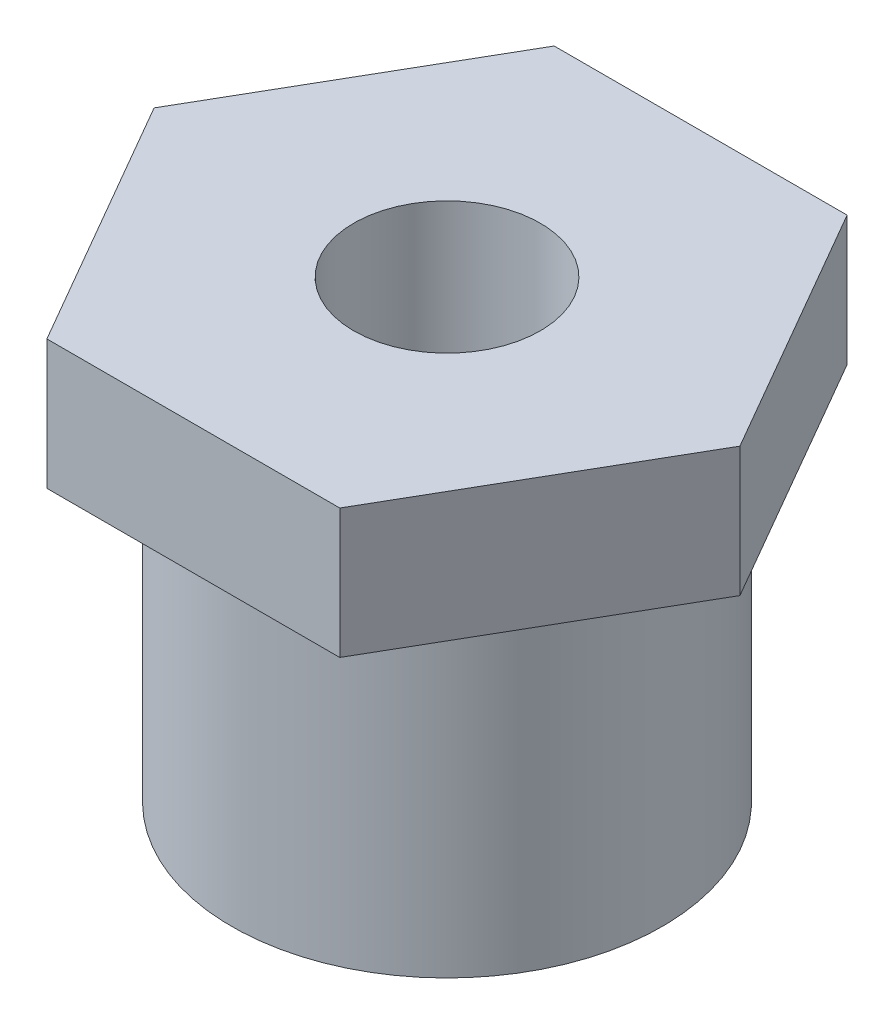
from build123d import *

# Parameters (mm, degrees)
BOSS_EXTRUDE1_DEPTH = 8.0518
SKETCH2_R           = 13.39215
BOSS_EXTRUDE2_DEPTH = 20.2438
SKETCH3_R           = 5.8039
CUT_EXTRUDE1_DEPTH  = 10.3886
SKETCH4_R           = 8.0137
CUT_EXTRUDE2_DEPTH  = 16.1925


with BuildPart() as part:
    # Sketch1 → Boss-Extrude1 (new body)
    with BuildSketch(Plane(origin=(0, 0, 0), x_dir=(1, 0, 0), z_dir=(0, 1, 0))):
        Polygon((18.22088582, 0), (9.11044291, 15.77975), (-9.11044291, 15.77975), (-18.22088582, 0), (-9.11044291, -15.77975), (9.11044291, -15.77975), align=None)
    extrude(amount=BOSS_EXTRUDE1_DEPTH)

    # Sketch2 → Boss-Extrude2 (add)
    with BuildSketch(Plane(origin=(0, 0, 0), x_dir=(-1, 0, 0), z_dir=(0, -1, 0))):
        with Locations(Location((0, 0, 0), (0, 0, 90))):
            Circle(SKETCH2_R)
    extrude(amount=BOSS_EXTRUDE2_DEPTH)

    # Sketch3 → Cut-Extrude1 (cut)
    with BuildSketch(Plane(origin=(0, 8.0518, 0), x_dir=(1, 0, 0), z_dir=(0, 1, 0))):
        with Locations(Location((0, 0, 0), (0, 0, 270))):
            Circle(SKETCH3_R)
    extrude(amount=-CUT_EXTRUDE1_DEPTH, mode=Mode.SUBTRACT)

    # Sketch4 → Cut-Extrude2 (cut)
    with BuildSketch(Plane.XZ.offset(20.2438)):
        with Locations(Location((0, 0, 0), (0, 0, 270))):
            Circle(SKETCH4_R)
    extrude(amount=-CUT_EXTRUDE2_DEPTH, mode=Mode.SUBTRACT)

    # Sketch5 → Cut-Revolve4 (revolve, cut)
    with BuildSketch(Plane.XY, mode=Mode.PRIVATE) as cut_revolve4_sk:
        Polygon((0, -2.3368), (0, -4.0513), (-8.0137, -4.0513), (-5.8039, -2.3368), align=None)
    revolve(cut_revolve4_sk.sketch.rotate(Axis((0, -2.3368, 0), (0, -1, 0)), 270), axis=Axis((0, -2.3368, 0), (0, -1, 0)), mode=Mode.SUBTRACT)


solid = part.part
